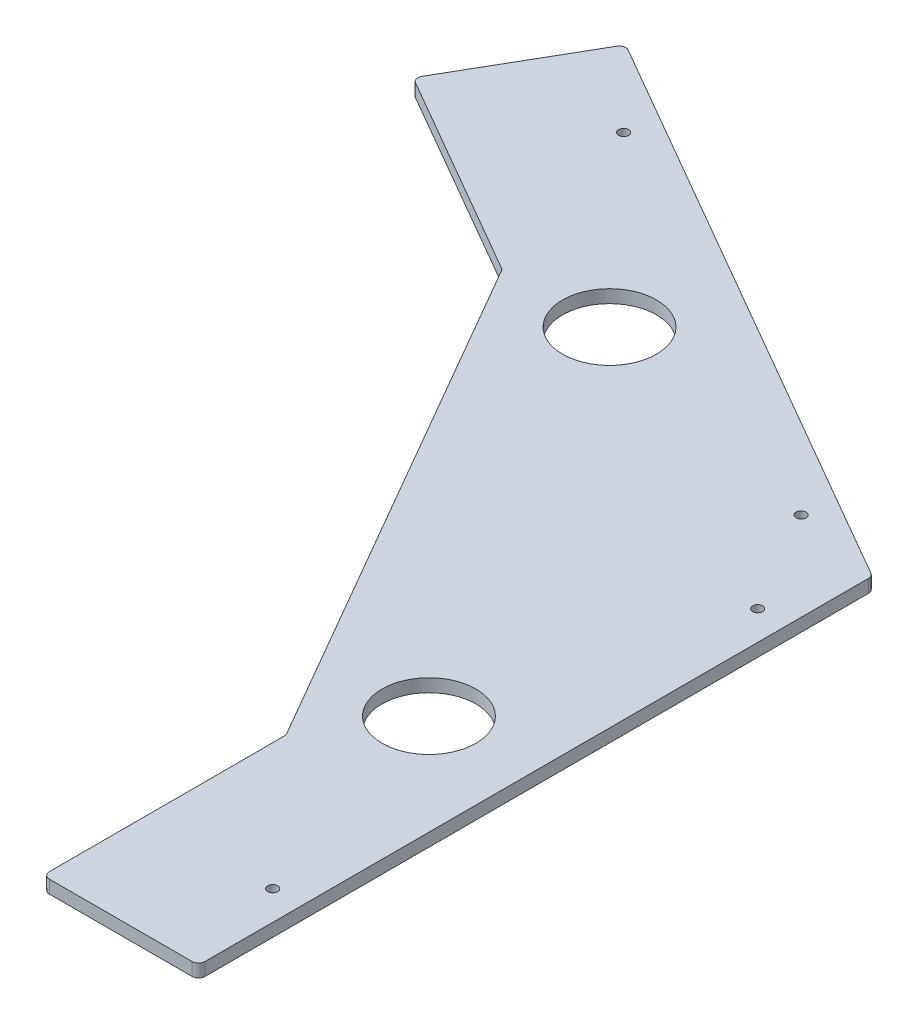
from build123d import *

# Parameters (mm, degrees)
SKETCH1_R           = 23.01875
SKETCH1_R_2         = 2.45745
BOSS_EXTRUDE1_DEPTH = 6.35
FILLET1_R           = 3.175


with BuildPart() as part:
    # Sketch1 → Boss-Extrude1 (new body)
    with BuildSketch(Plane(origin=(0, 0, 0), x_dir=(1, 0, 0), z_dir=(0, 1, 0))):
        Polygon((0, 0), (0, 329.955678842), (-285.75, 494.933518263), (-323.85, 428.942382494), (-220.760110958, 369.423407305), (-76.2, 119.037950379), (-76.2, 0), align=None)
        with Locations(Location((-49.2125, 162.06103122, 0), (0, 0, 270))):
            Circle(SKETCH1_R, mode=Mode.SUBTRACT)
        with Locations(Location((-170.00728, 371.283727469, 0), (0, 0, 270))):
            Circle(SKETCH1_R, mode=Mode.SUBTRACT)
        with Locations(Location((-14.2875, 50.607868786, 0), (0, 0, 270))):
            Circle(SKETCH1_R_2, mode=Mode.SUBTRACT)
        with Locations(Location((-14.2875, 288.082628786, 0), (0, 0, 270))):
            Circle(SKETCH1_R_2, mode=Mode.SUBTRACT)
        with Locations(Location((-43.406875082, 338.518865913, 0), (0, 0, 270))):
            Circle(SKETCH1_R_2, mode=Mode.SUBTRACT)
        with Locations(Location((-249.06605, 457.256245913, 0), (0, 0, 270))):
            Circle(SKETCH1_R_2, mode=Mode.SUBTRACT)
    extrude(amount=BOSS_EXTRUDE1_DEPTH)

    # Fillet1
    fillet1_edges = [part.edges().sort_by_distance(p)[0] for p in [
        (-76.2, 3.175, 0),
        (-76.2, 3.175, -119.037950379),
        (-220.760110958, 3.175, -369.423407305),
        (-323.85, 3.175, -428.942382494),
        (-285.75, 3.175, -494.933518263),
        (0, 3.175, -329.955678842),
        (0, 3.175, 0),
    ]]
    fillet(fillet1_edges, radius=FILLET1_R)


solid = part.part
